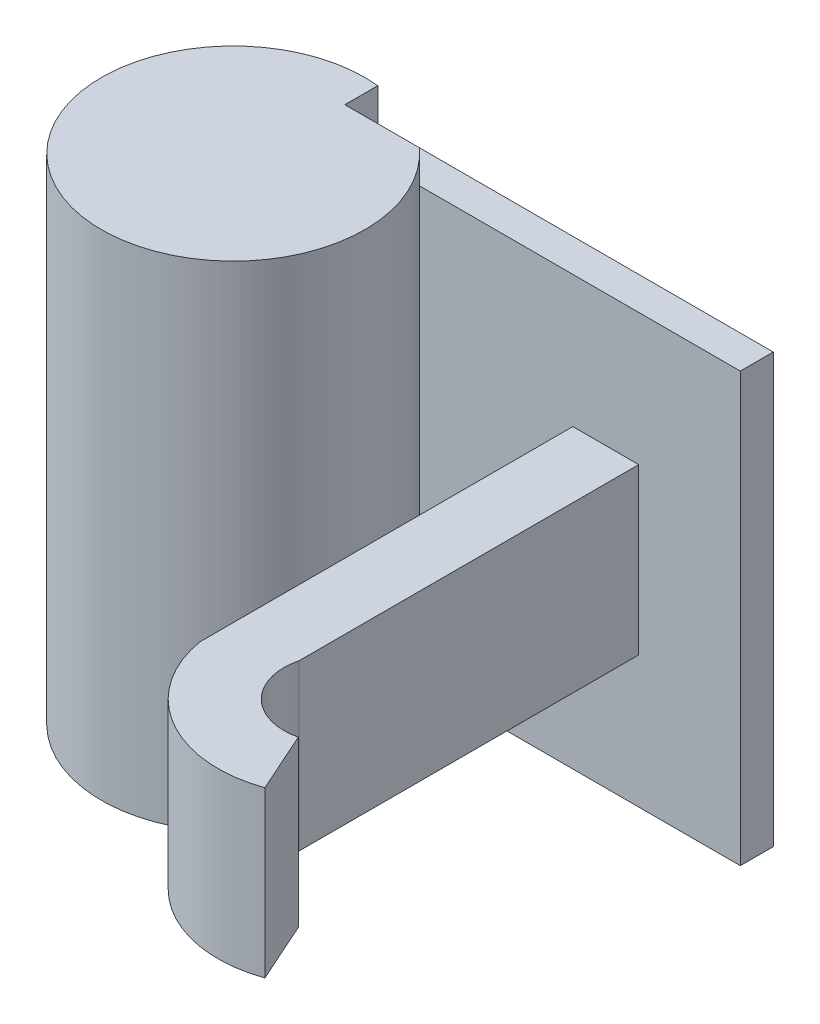
from build123d import *

# Parameters (mm, degrees)
BOSS_EXTRUDE1_DEPTH = 15
SKETCH2_W           = 12
SKETCH2_H           = 1
CUT_EXTRUDE1_DEPTH  = 1
SKETCH5_W           = 6.028776927
SKETCH5_H           = 6.351314433
SKETCH5_W_2         = 5.976909526
SKETCH5_H_2         = 6.219071559
CUT_EXTRUDE2_DEPTH  = 21


with BuildPart() as part:
    # Sketch1 → Boss-Extrude1 (new body)
    with BuildSketch(Plane(origin=(0, 0, 0), x_dir=(1, 0, 0), z_dir=(0, 1, 0))):
        with BuildLine():
            ThreePointArc((-26.508767977, 45.209827562), (-26.856482836, 46.841027505), (-27.839174603, 48.188631218))
            Line((-27.839174603, 48.188631218), (-30.097524166, 48.188631218))
            Line((-30.097524166, 48.188631218), (-30.097524166, 49.188631218))
            ThreePointArc((-30.097524166, 49.188631218), (-33.479035241, 42.530739587), (-26.508767977, 45.209827562))
        make_face()
        with BuildLine():
            Line((-30.097524166, 48.188631218), (-27.839174603, 48.188631218))
            ThreePointArc((-27.839174603, 48.188631218), (-28.889234266, 48.86730081), (-30.097524166, 49.188631218))
            Line((-30.097524166, 49.188631218), (-30.097524166, 48.188631218))
        make_face()
        with BuildLine():
            Line((-27.839174603, 48.188631218), (-23.179530848, 48.188631218))
            Line((-23.179530848, 48.188631218), (-21.179530848, 48.188631218))
            Line((-21.179530848, 48.188631218), (-18.097524166, 48.188631218))
            Line((-18.097524166, 48.188631218), (-18.097524166, 49.188631218))
            Line((-18.097524166, 49.188631218), (-30.097524166, 49.188631218))
            ThreePointArc((-30.097524166, 49.188631218), (-28.889234266, 48.86730081), (-27.839174603, 48.188631218))
        make_face()
        with BuildLine():
            Line((-23.179530848, 48.188631218), (-23.179530848, 38.073593242))
            ThreePointArc((-23.179530848, 38.073593242), (-22.504394786, 39.656834499), (-21.179530848, 40.755559728))
            Line((-21.179530848, 40.755559728), (-21.179530848, 48.188631218))
            Line((-21.179530848, 48.188631218), (-23.179530848, 48.188631218))
        make_face()
        with BuildLine():
            Line((-21.179530848, 36.869987329), (-21.179530848, 37.062229248))
            ThreePointArc((-21.179530848, 37.062229248), (-21.23095476, 37.471790285), (-21.179530848, 37.881351323))
            Line((-21.179530848, 37.881351323), (-21.179530848, 40.755559728))
            ThreePointArc((-21.179530848, 40.755559728), (-22.504394786, 39.656834499), (-23.179530848, 38.073593242))
            Line((-23.179530848, 38.073593242), (-23.179530848, 36.869987329))
            Line((-23.179530848, 36.869987329), (-21.179530848, 36.869987329))
        make_face()
        with BuildLine():
            Line((-18.360117838, 34.024219809), (-19.183298893, 35.861921993))
            ThreePointArc((-19.183298893, 35.861921993), (-20.42797821, 36.052015934), (-21.179530848, 37.062229248))
            Line((-21.179530848, 37.062229248), (-21.179530848, 36.869987329))
            Line((-21.179530848, 36.869987329), (-23.179530848, 36.869987329))
            ThreePointArc((-23.179530848, 36.869987329), (-21.43275623, 34.324403792), (-18.360117838, 34.024219809))
        make_face()
    extrude(amount=BOSS_EXTRUDE1_DEPTH)

    # Sketch2 → Cut-Extrude1 (cut)
    with BuildSketch(Plane(origin=(0, 0, -49.188631218), x_dir=(-1, 0, 0), z_dir=(0, 0, -1))):
        with Locations((24.097524166, 14.5)):
            Rectangle(SKETCH2_W, SKETCH2_H)
        with Locations((24.097524166, 0.5)):
            Rectangle(SKETCH2_W, SKETCH2_H)
    extrude(amount=-CUT_EXTRUDE1_DEPTH, mode=Mode.SUBTRACT)

    # Sketch5 → Cut-Extrude2 (cut)
    with BuildSketch(Plane(origin=(0, 0, -48.188631218), x_dir=(-1, 0, 0), z_dir=(0, 0, -1))):
        with Locations((20.800096239, 13.175657217)):
            Rectangle(SKETCH5_W, SKETCH5_H)
        with Locations((20.774162538, 1.89046422)):
            Rectangle(SKETCH5_W_2, SKETCH5_H_2)
    extrude(amount=-CUT_EXTRUDE2_DEPTH, mode=Mode.SUBTRACT)


solid = part.part
